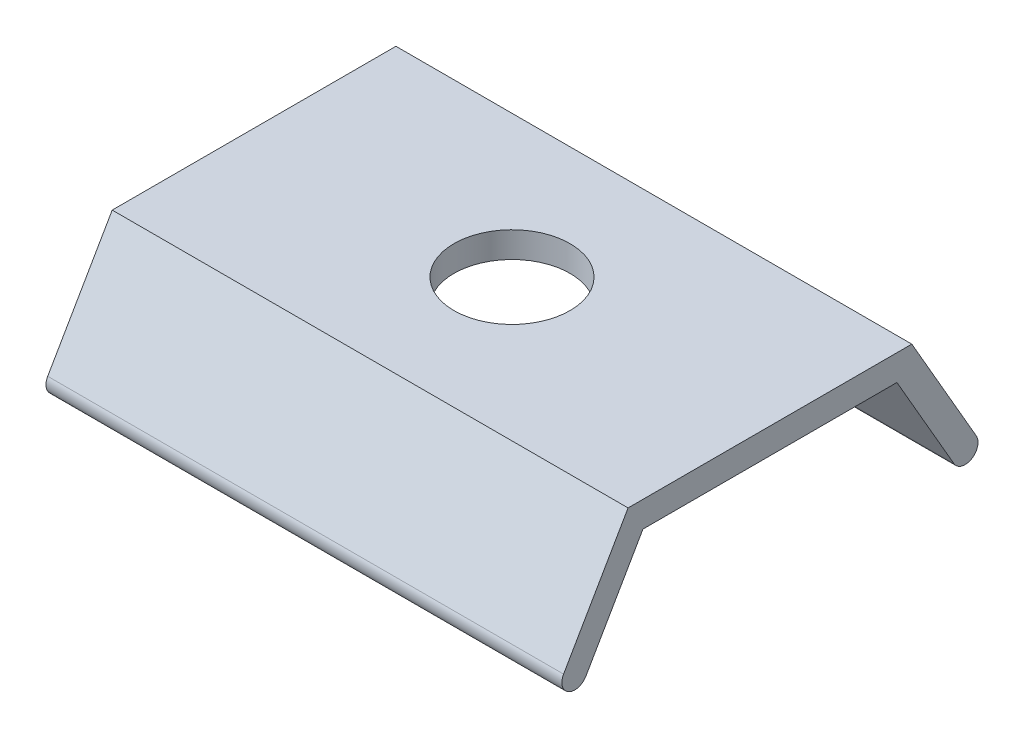
from build123d import *

# Parameters (mm, degrees)
BOSS_EXTRUDE1_DEPTH  = 10
M4_CLEARANCE_HOLE1_D = 4.5


with BuildPart() as part:
    # Sketch1 → Boss-Extrude1 (new, symmetric)
    with BuildSketch(Plane(origin=(0, 0, 0), x_dir=(0, 0, -1), z_dir=(1, 0, 0))):
        with BuildLine():
            Line((-5.5, 0), (5.5, 0))
            Line((5.5, 0), (8, -4.330127019))
            ThreePointArc((8, -4.330127019), (7.816987298, -5.013139721), (7.133974596, -4.830127019))
            Line((7.133974596, -4.830127019), (4.922649731, -1))
            Line((4.922649731, -1), (-4.922649731, -1))
            Line((-4.922649731, -1), (-7.133974596, -4.830127019))
            ThreePointArc((-7.133974596, -4.830127019), (-7.816987298, -5.013139721), (-8, -4.330127019))
            Line((-8, -4.330127019), (-5.5, 0))
        make_face()
    extrude(amount=BOSS_EXTRUDE1_DEPTH, both=True)

    # M4 Clearance Hole1 (through all)
    with Locations(Plane(origin=(0, 0, 0), x_dir=(1, 0, 0), z_dir=(0, 1, 0))):
        with Locations((0, 0)):
            Hole(M4_CLEARANCE_HOLE1_D / 2)


solid = part.part
